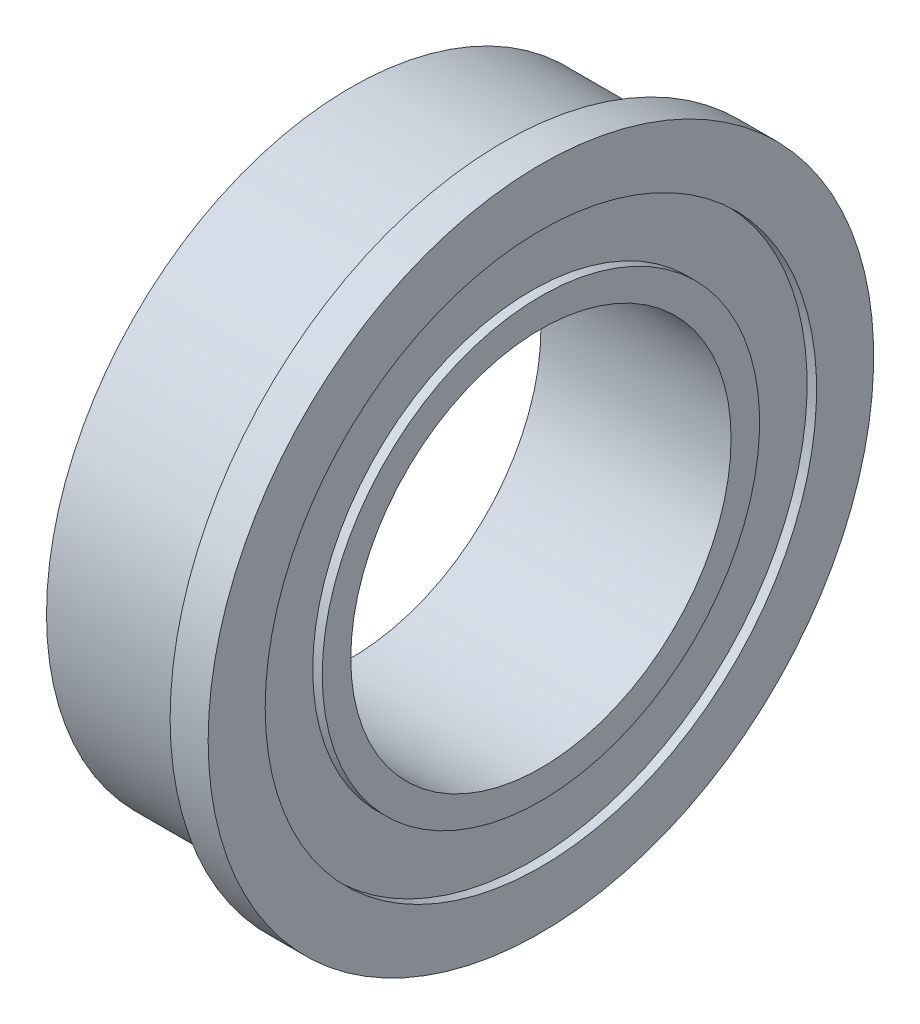
from build123d import *


with BuildPart() as part:
    # 草图1 → 旋转1 (revolve)
    with BuildSketch(Plane(origin=(0, 0, 0), x_dir=(1, 0, 0), z_dir=(0, 1, 0)), mode=Mode.PRIVATE) as revolve_1_sk:
        Polygon((0, 10), (10, 10), (10, 11.5), (9.5, 11.5), (9.5, 14.5), (10, 14.5), (10, 17.5), (8, 17.5), (8, 16), (0, 16), (0, 14.5), (0.5, 14.5), (0.5, 11.5), (0, 11.5), align=None)
    revolve(revolve_1_sk.sketch.rotate(Axis((0, 0, 0), (1, 0, 0)), 180), axis=Axis((0, 0, 0), (1, 0, 0)))


solid = part.part
